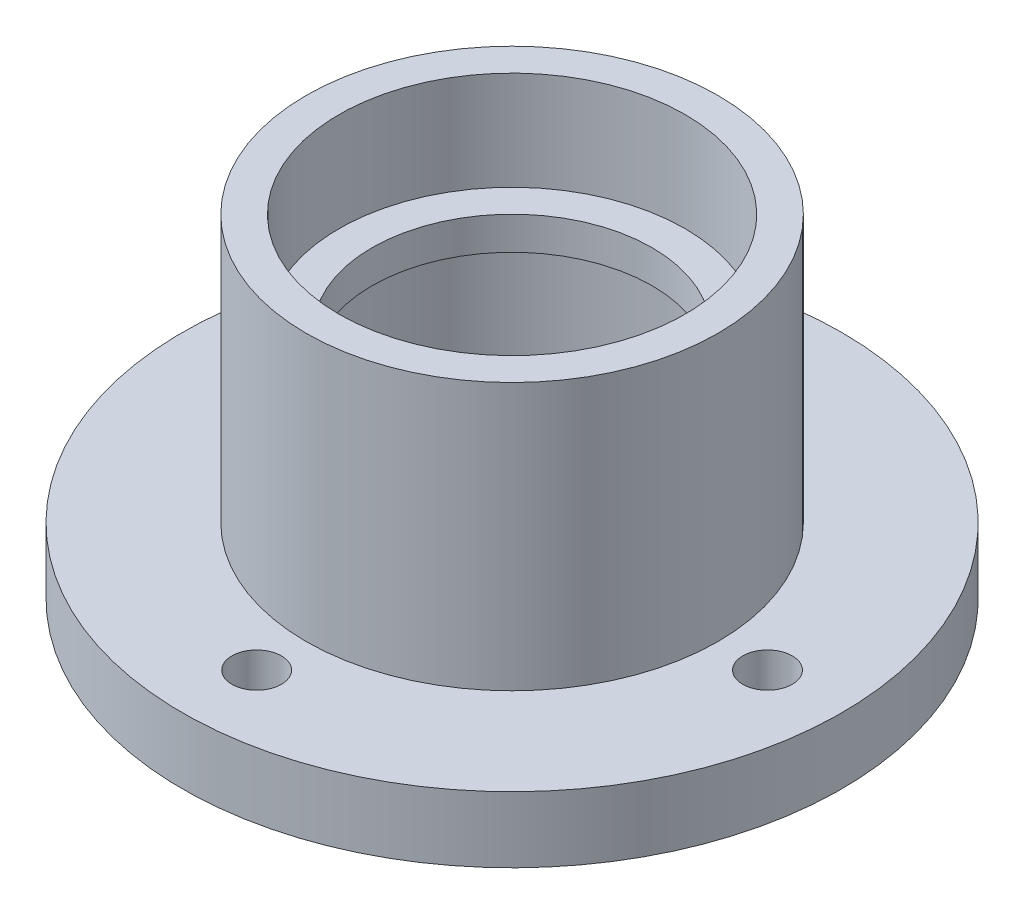
from build123d import *

# Parameters (mm, degrees)
SKETCH2_R          = 1.5
CUT_EXTRUDE1_DEPTH = 33.595091655


with BuildPart() as part:
    # Sketch1 → Revolve1 (revolve)
    with BuildSketch(Plane.XY, mode=Mode.PRIVATE) as revolve1_sk:
        Polygon((-10.5, 20.2), (-10.5, 14.2), (-8.5, 14.2), (-8.5, 12.2), (-10.5, 12.2), (-10.5, 0), (-20, 0), (-20, 4), (-12.5, 4), (-12.5, 20.2), align=None)
    revolve(revolve1_sk.sketch.rotate(Axis((0, 0, 0), (0, 1, 0)), 270), axis=Axis((0, 0, 0), (0, 1, 0)))

    # Sketch2 → Cut-Extrude1 (cut, through all)
    with BuildSketch(Plane(origin=(0, 4, 0), x_dir=(1, 0, 0), z_dir=(0, 1, 0))):
        with Locations(Location((0, 15.5, 0), (0, 0, 270))):
            Circle(SKETCH2_R)
        with Locations(Location((15.5, 0, 0), (0, 0, 270))):
            Circle(SKETCH2_R)
        with Locations(Location((0, -15.5, 0), (0, 0, 270))):
            Circle(SKETCH2_R)
        with Locations(Location((-15.5, 0, 0), (0, 0, 270))):
            Circle(SKETCH2_R)
    extrude(amount=-CUT_EXTRUDE1_DEPTH, mode=Mode.SUBTRACT)


solid = part.part
